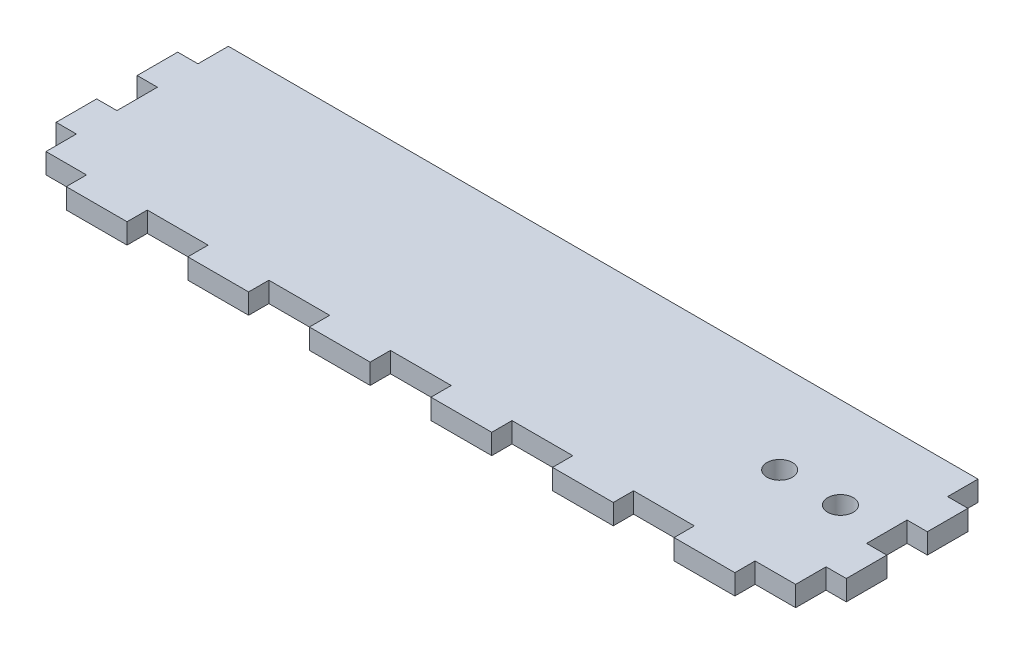
from build123d import *

# Parameters (mm, degrees)
ESQUISSE1_W                     = 234.95
ESQUISSE1_H                     = 57.15
BOSS_EXTRU_1_DEPTH              = 6.35
ESQUISSE3_W                     = 19.05
ESQUISSE3_H                     = 6.35
BOSS_EXTRU_2_DEPTH              = 6.35
R_P_TITION_LIN_AIRE2_COUNT      = 6
R_P_TITION_LIN_AIRE2_PITCH      = 38.1
ESQUISSE5_W                     = 6.35
ESQUISSE5_H                     = 12.7
BOSS_EXTRU_4_DEPTH              = 6.35
R_P_TITION_LIN_AIRE4_COUNT      = 2
R_P_TITION_LIN_AIRE4_PITCH      = 25.4
R_P_TITION_LIN_AIRE4_COUNT_DIR2 = 2
R_P_TITION_LIN_AIRE4_PITCH_DIR2 = 241.3
ESQUISSE2_R                     = 4
ENL_V_MAT_EXTRU_1_DEPTH         = 6.35


with BuildPart() as part:
    # Esquisse1 → Boss.-Extru.1 (new body)
    with BuildSketch(Plane(origin=(0, 0, 0), x_dir=(1, 0, 0), z_dir=(0, 1, 0))):
        Rectangle(ESQUISSE1_W, ESQUISSE1_H)
    extrude(amount=BOSS_EXTRU_1_DEPTH)

    # Esquisse3 → Boss.-Extru.2 (add)
    with BuildSketch(Plane(origin=(0, 6.35, 0), x_dir=(1, 0, 0), z_dir=(0, 1, 0))):
        with Locations((-95.25, -31.75)):
            Rectangle(ESQUISSE3_W, ESQUISSE3_H)
    boss_extru_2 = extrude(amount=-BOSS_EXTRU_2_DEPTH)

    # Répétition linéaire2: Boss.-Extru.2 ×6
    with Locations(*[(i * R_P_TITION_LIN_AIRE2_PITCH, 0, 0) for i in range(1, R_P_TITION_LIN_AIRE2_COUNT)]):
        add(boss_extru_2)

    # Esquisse5 → Boss.-Extru.4 (add)
    with BuildSketch(Plane(origin=(0, 6.35, 0), x_dir=(1, 0, 0), z_dir=(0, 1, 0))):
        with Locations((-120.65, -12.7)):
            Rectangle(ESQUISSE5_W, ESQUISSE5_H)
    boss_extru_4 = extrude(amount=-BOSS_EXTRU_4_DEPTH)

    # Répétition linéaire4: Boss.-Extru.4 2 × 2
    with Locations(*[(j * R_P_TITION_LIN_AIRE4_PITCH_DIR2, 0, -i * R_P_TITION_LIN_AIRE4_PITCH) for i in range(R_P_TITION_LIN_AIRE4_COUNT) for j in range(R_P_TITION_LIN_AIRE4_COUNT_DIR2) if (i, j) != (0, 0)]):
        add(boss_extru_4)

    # Esquisse2 → Enlèv. mat.-Extru.1 (cut)
    with BuildSketch(Plane(origin=(0, 6.35, 0), x_dir=(1, 0, 0), z_dir=(0, 1, 0))):
        with Locations(Location((83.895833333, 0, 0), (0, 0, 270))):
            Circle(ESQUISSE2_R)
        with Locations(Location((102.945833333, 0, 0), (0, 0, 270))):
            Circle(ESQUISSE2_R)
    extrude(amount=-ENL_V_MAT_EXTRU_1_DEPTH, mode=Mode.SUBTRACT)


solid = part.part
